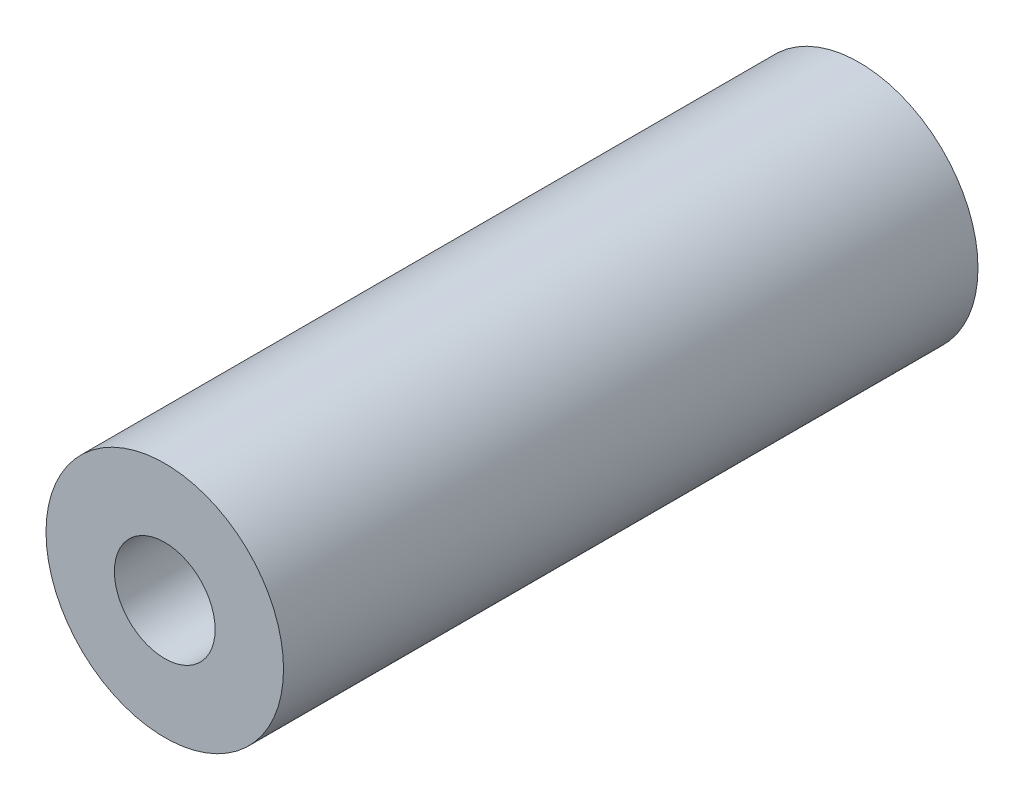
from build123d import *

# Parameters (mm, degrees)
SKETCH1_R                            = 4.7625
BOSS_EXTRUDE1_DEPTH                  = 13.924799938
F_10_32_TAPPED_HOLE1_D               = 4.0386
F_10_32_TAPPED_HOLE1_DEPTH           = 14.986
F_10_32_TAPPED_HOLE1_TIP             = 1.213317848
F_10_32_TAPPED_HOLE1_ON_FACE_2_D     = 4.0386
F_10_32_TAPPED_HOLE1_ON_FACE_2_DEPTH = 14.986
F_10_32_TAPPED_HOLE1_ON_FACE_2_TIP   = 1.213317848


with BuildPart() as part:
    # Sketch1 → Boss-Extrude1 (new, symmetric)
    with BuildSketch(Plane.XY):
        with Locations(Location((0, 0, 0), (0, 0, 180))):
            Circle(SKETCH1_R)
    extrude(amount=BOSS_EXTRUDE1_DEPTH, both=True)

    # #10-32 Tapped Hole1
    with Locations(Plane.XY.offset(13.924799938)):
        with Locations((0, 0)):
            Hole(F_10_32_TAPPED_HOLE1_D / 2, depth=F_10_32_TAPPED_HOLE1_DEPTH)
            with Locations((0, 0, -(F_10_32_TAPPED_HOLE1_DEPTH + F_10_32_TAPPED_HOLE1_TIP / 2))):  # 118° drill point
                Cone(0, F_10_32_TAPPED_HOLE1_D / 2, F_10_32_TAPPED_HOLE1_TIP, mode=Mode.SUBTRACT)

    # #10-32 Tapped Hole1 on face 2
    with Locations(Plane(origin=(0, 0, -13.924799938), x_dir=(-1, 0, 0), z_dir=(0, 0, -1))):
        with Locations((0, 0)):
            Hole(F_10_32_TAPPED_HOLE1_ON_FACE_2_D / 2, depth=F_10_32_TAPPED_HOLE1_ON_FACE_2_DEPTH)
            with Locations((0, 0, -(F_10_32_TAPPED_HOLE1_ON_FACE_2_DEPTH + F_10_32_TAPPED_HOLE1_ON_FACE_2_TIP / 2))):  # 118° drill point
                Cone(0, F_10_32_TAPPED_HOLE1_ON_FACE_2_D / 2, F_10_32_TAPPED_HOLE1_ON_FACE_2_TIP, mode=Mode.SUBTRACT)


solid = part.part
